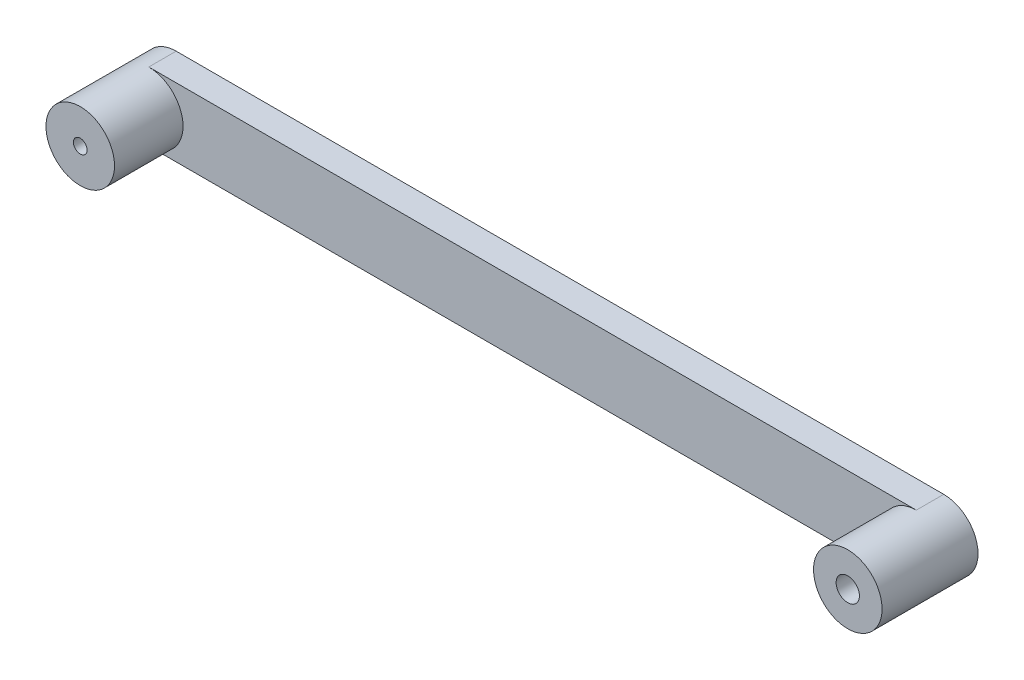
from build123d import *

# Parameters (mm, degrees)
RESSALTO_EXTRUS_O1_DEPTH = 2
ESBO_O3_R                = 2.5
RESSALTO_EXTRUS_O2_DEPTH = 5
ESBO_O5_R                = 2.5
RESSALTO_EXTRUS_O3_DEPTH = 5
ESBO_O2_R                = 0.5
CORTE_EXTRUS_O1_DEPTH    = 32.392674305
ESBO_O4_R                = 0.85
CORTE_EXTRUS_O2_DEPTH    = 32.392674305


with BuildPart() as part:
    # Esboço1 → Ressalto-extrusão1 (new body)
    with BuildSketch(Plane.XY):
        with BuildLine():
            Line((-28, 2.5), (28, 2.5))
            ThreePointArc((28, 2.5), (30.5, 0), (28, -2.5))
            Line((28, -2.5), (-28, -2.5))
            ThreePointArc((-28, -2.5), (-30.5, 0), (-28, 2.5))
        make_face()
    extrude(amount=RESSALTO_EXTRUS_O1_DEPTH)

    # Esboço3 → Ressalto-extrusão2 (add)
    with BuildSketch(Plane.XY.offset(2)):
        with Locations(Location((28, 0, 0), (0, 0, 90))):
            Circle(ESBO_O3_R)
    extrude(amount=RESSALTO_EXTRUS_O2_DEPTH)

    # Esboço5 → Ressalto-extrusão3 (add)
    with BuildSketch(Plane.XY.offset(2)):
        with Locations(Location((-28, 0, 0), (0, 0, 270))):
            Circle(ESBO_O5_R)
    extrude(amount=RESSALTO_EXTRUS_O3_DEPTH)

    # Esboço2 → Corte-extrusão1 (cut, through all)
    with BuildSketch(Plane.XY.offset(7)):
        with Locations((-28, 0)):
            Circle(ESBO_O2_R)
    extrude(amount=-CORTE_EXTRUS_O1_DEPTH, mode=Mode.SUBTRACT)

    # Esboço4 → Corte-extrusão2 (cut, through all)
    with BuildSketch(Plane.XY.offset(7)):
        with Locations((28, 0)):
            Circle(ESBO_O4_R)
    extrude(amount=-CORTE_EXTRUS_O2_DEPTH, mode=Mode.SUBTRACT)


solid = part.part
